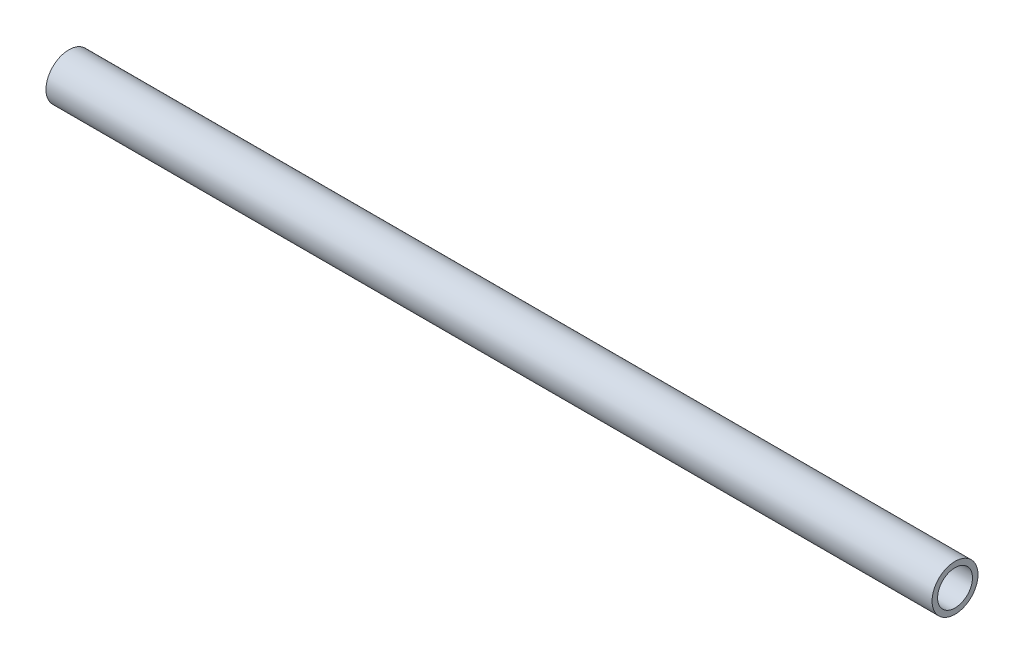
from build123d import *

# Parameters (mm, degrees)
SKETCH1_R           = 12.7
SKETCH1_R_2         = 9.652
BOSS_EXTRUDE1_DEPTH = 490


with BuildPart() as part:
    # Sketch1 → Boss-Extrude1 (new body)
    with BuildSketch(Plane(origin=(0, 0, 0), x_dir=(0, 0, -1), z_dir=(1, 0, 0))):
        Circle(SKETCH1_R)
        Circle(SKETCH1_R_2, mode=Mode.SUBTRACT)
    extrude(amount=BOSS_EXTRUDE1_DEPTH)


solid = part.part
